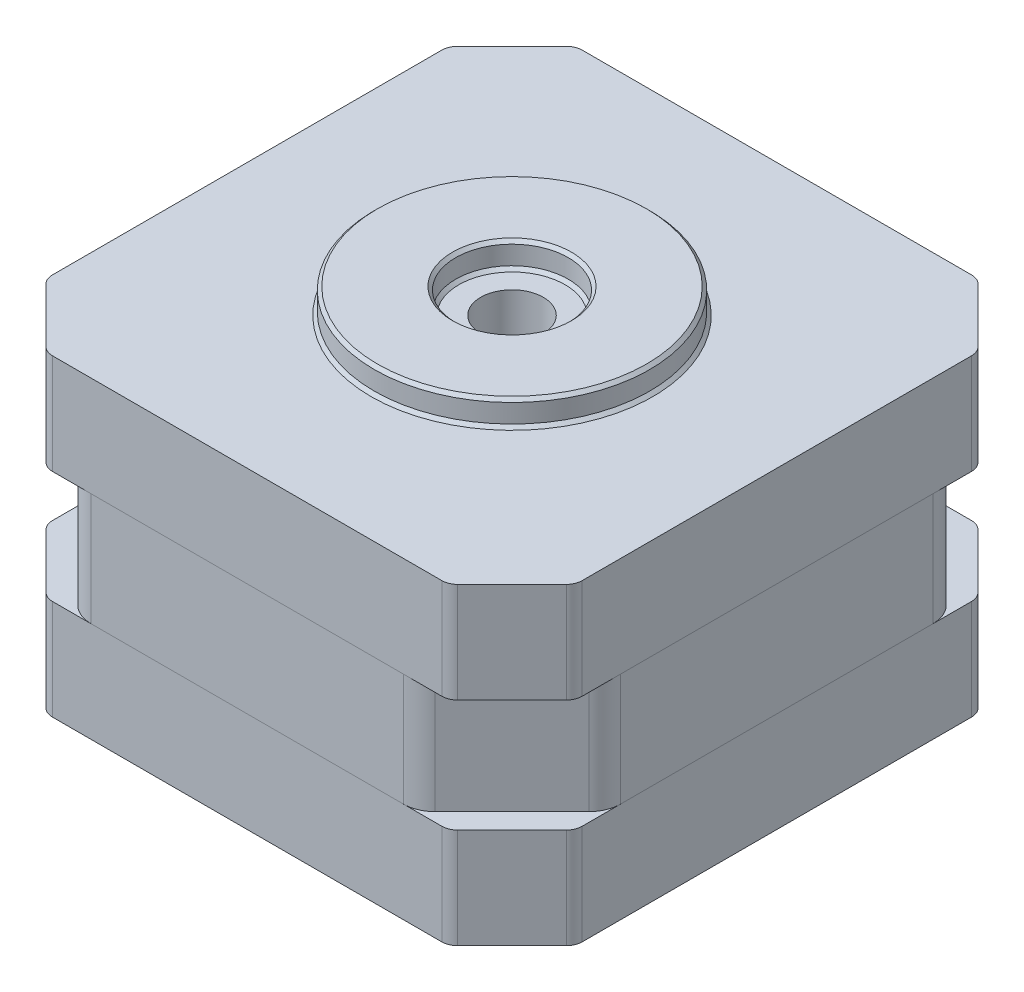
from build123d import *

# Parameters (mm, degrees)
SKETCH1_W           = 42.3
SKETCH1_H           = 42.3
BOSS_EXTRUDE1_DEPTH = 8.001
CHAMFER1_SIZE       = 5.08
SKETCH2_W           = 42.3
SKETCH2_H           = 42.3
BOSS_EXTRUDE2_DEPTH = 8.9916
CHAMFER3_SIZE       = 7.62
FILLET1_R           = 2.54
FILLET2_R           = 1.27
SKETCH3_W           = 42.3
SKETCH3_H           = 42.3
BOSS_EXTRUDE3_DEPTH = 8.001
CHAMFER4_SIZE       = 5.08
FILLET3_R           = 1.27
SKETCH4_R           = 10.9982
SKETCH4_R_2         = 4.4958
BOSS_EXTRUDE4_DEPTH = 2
CHAMFER5_SIZE       = 0.254
SKETCH5_R           = 2.5019
CUT_EXTRUDE1_DEPTH  = 12.7


with BuildPart() as part:
    # Sketch1 → Boss-Extrude1 (new body)
    with BuildSketch(Plane(origin=(0, 0, 0), x_dir=(1, 0, 0), z_dir=(0, 1, 0))):
        Rectangle(SKETCH1_W, SKETCH1_H)
    extrude(amount=BOSS_EXTRUDE1_DEPTH)

    # Chamfer1
    chamfer1_edges = [part.edges().sort_by_distance(p)[0] for p in [
        (21.15, 4.0005, 21.15),
        (-21.15, 4.0005, 21.15),
        (-21.15, 4.0005, -21.15),
        (21.15, 4.0005, -21.15),
    ]]
    chamfer(chamfer1_edges, length=CHAMFER1_SIZE)

    # Fillet2
    fillet2_edges = [part.edges().sort_by_distance(p)[0] for p in [
        (16.07, 4.0005, 21.15),
        (-16.07, 4.0005, 21.15),
        (-21.15, 4.0005, -16.07),
        (-21.15, 4.0005, 16.07),
        (16.07, 4.0005, -21.15),
        (-16.07, 4.0005, -21.15),
        (21.15, 4.0005, 16.07),
        (21.15, 4.0005, -16.07),
    ]]
    fillet(fillet2_edges, radius=FILLET2_R)


with BuildPart() as body_2:
    # Sketch2 → Boss-Extrude2 (new body)
    with BuildSketch(Plane(origin=(0, 8.001, 0), x_dir=(1, 0, 0), z_dir=(0, 1, 0))):
        Rectangle(SKETCH2_W, SKETCH2_H)
    extrude(amount=BOSS_EXTRUDE2_DEPTH)

    # Chamfer3
    chamfer3_edges = [body_2.edges().sort_by_distance(p)[0] for p in [
        (21.15, 12.4968, 21.15),
        (-21.15, 12.4968, 21.15),
        (-21.15, 12.4968, -21.15),
        (21.15, 12.4968, -21.15),
    ]]
    chamfer(chamfer3_edges, length=CHAMFER3_SIZE)

    # Fillet1
    fillet1_edges = [body_2.edges().sort_by_distance(p)[0] for p in [
        (-21.15, 12.4968, 13.53),
        (-21.15, 12.4968, -13.53),
        (13.53, 12.4968, -21.15),
        (-13.53, 12.4968, -21.15),
        (13.53, 12.4968, 21.15),
        (-13.53, 12.4968, 21.15),
        (21.15, 12.4968, -13.53),
        (21.15, 12.4968, 13.53),
    ]]
    fillet(fillet1_edges, radius=FILLET1_R)


with BuildPart() as body_3:
    # Sketch3 → Boss-Extrude3 (new body)
    with BuildSketch(Plane(origin=(0, 16.9926, 0), x_dir=(1, 0, 0), z_dir=(0, 1, 0))):
        Rectangle(SKETCH3_W, SKETCH3_H)
    extrude(amount=BOSS_EXTRUDE3_DEPTH)

    # Chamfer4
    chamfer4_edges = [body_3.edges().sort_by_distance(p)[0] for p in [
        (21.15, 20.9931, 21.15),
        (-21.15, 20.9931, 21.15),
        (-21.15, 20.9931, -21.15),
        (21.15, 20.9931, -21.15),
    ]]
    chamfer(chamfer4_edges, length=CHAMFER4_SIZE)

    # Fillet3
    fillet3_edges = [body_3.edges().sort_by_distance(p)[0] for p in [
        (16.07, 20.9931, 21.15),
        (-16.07, 20.9931, 21.15),
        (-21.15, 20.9931, -16.07),
        (-21.15, 20.9931, 16.07),
        (16.07, 20.9931, -21.15),
        (-16.07, 20.9931, -21.15),
        (21.15, 20.9931, 16.07),
        (21.15, 20.9931, -16.07),
    ]]
    fillet(fillet3_edges, radius=FILLET3_R)

    # Sketch4 → Boss-Extrude4 (add)
    with BuildSketch(Plane(origin=(0, 24.9936, 0), x_dir=(1, 0, 0), z_dir=(0, 1, 0))):
        with Locations(Location((0, 0, 0), (0, 0, 270))):
            Circle(SKETCH4_R)
        with Locations(Location((0, 0, 0), (0, 0, 270))):
            Circle(SKETCH4_R_2, mode=Mode.SUBTRACT)
    extrude(amount=BOSS_EXTRUDE4_DEPTH)

    # Chamfer5
    chamfer5_edges = [body_3.edges().sort_by_distance(p)[0] for p in [
        (0, 26.9936, -10.9982),
        (0, 24.9936, -10.9982),
        (0, 26.9936, -4.4958),
        (0, 24.9936, -4.4958),
    ]]
    chamfer(chamfer5_edges, length=CHAMFER5_SIZE)


with BuildPart() as cut_extrude1_tool:
    # Sketch5 → Cut-Extrude1 (new body)
    with BuildSketch(Plane(origin=(0, 24.9936, 0), x_dir=(1, 0, 0), z_dir=(0, 1, 0))):
        with Locations(Location((0, 0, 0), (0, 0, 270))):
            Circle(SKETCH5_R)
    extrude(amount=-CUT_EXTRUDE1_DEPTH)


with BuildPart() as body_2_1:
    add(body_2.part)

    # Cut-Extrude1: cut by cut_extrude1_tool
    add(cut_extrude1_tool.part, mode=Mode.SUBTRACT)


with BuildPart() as body_3_1:
    add(body_3.part)

    # Cut-Extrude1: cut by cut_extrude1_tool
    add(cut_extrude1_tool.part, mode=Mode.SUBTRACT)


solid = Compound([part.part, body_2_1.part, body_3_1.part])
